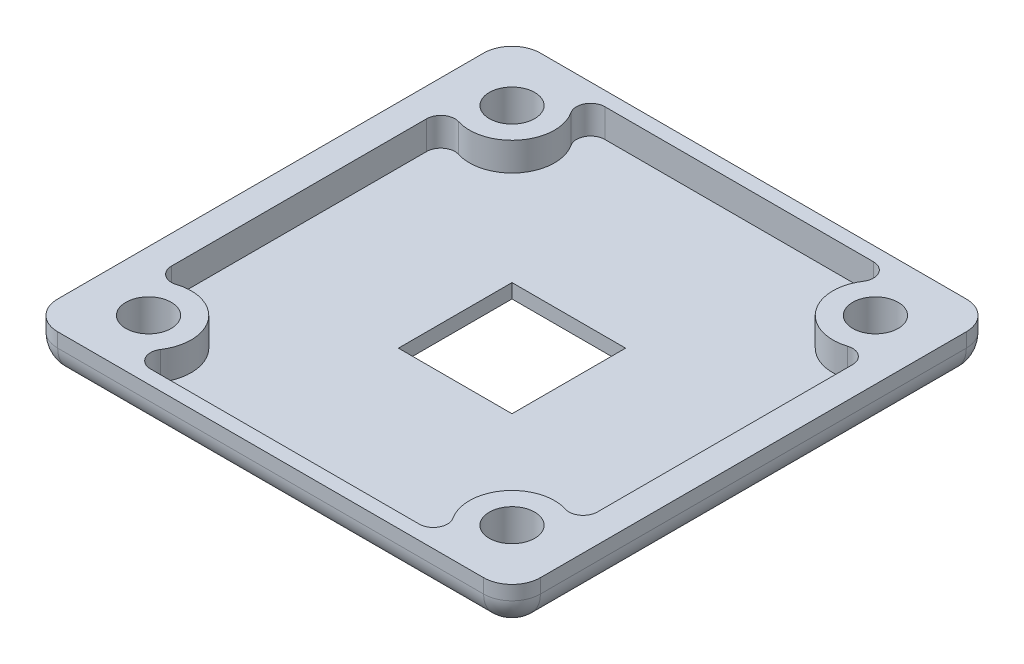
from build123d import *

# Parameters (mm, degrees)
SKETCH1_W           = 26.9875
SKETCH1_H           = 26.9875
BOSS_EXTRUDE1_DEPTH = 2.38125
SKETCH2_W           = 6.35
SKETCH2_H           = 6.35
CUT_EXTRUDE1_DEPTH  = 20.231040785
SKETCH3_R           = 1.27
CUT_EXTRUDE2_DEPTH  = 20.231040785
CUT_EXTRUDE3_DEPTH  = 1.5875
FILLET1_R           = 1.5875
FILLET2_R           = 1.5875


with BuildPart() as part:
    # Sketch1 → Boss-Extrude1 (new body)
    with BuildSketch(Plane(origin=(0, 0, 0), x_dir=(1, 0, 0), z_dir=(0, 1, 0))):
        Rectangle(SKETCH1_W, SKETCH1_H)
    extrude(amount=BOSS_EXTRUDE1_DEPTH)

    # Sketch2 → Cut-Extrude1 (cut, through all)
    with BuildSketch(Plane(origin=(0, 2.38125, 0), x_dir=(1, 0, 0), z_dir=(0, 1, 0))):
        Rectangle(SKETCH2_W, SKETCH2_H)
    extrude(amount=-CUT_EXTRUDE1_DEPTH, mode=Mode.SUBTRACT)

    # Sketch3 → Cut-Extrude2 (cut, through all)
    with BuildSketch(Plane(origin=(0, 2.38125, 0), x_dir=(1, 0, 0), z_dir=(0, 1, 0))):
        with Locations(Location((-10.16, 10.16, 0), (0, 0, 270))):
            Circle(SKETCH3_R)
        with Locations(Location((10.16, 10.16, 0), (0, 0, 270))):
            Circle(SKETCH3_R)
        with Locations(Location((10.16, -10.16, 0), (0, 0, 270))):
            Circle(SKETCH3_R)
        with Locations(Location((-10.16, -10.16, 0), (0, 0, 270))):
            Circle(SKETCH3_R)
    extrude(amount=-CUT_EXTRUDE2_DEPTH, mode=Mode.SUBTRACT)

    # Sketch4 → Cut-Extrude3 (cut)
    with BuildSketch(Plane(origin=(0, 2.38125, 0), x_dir=(1, 0, 0), z_dir=(0, 1, 0))):
        with BuildLine():
            Line((-11.90625, -7.131243036), (-11.90625, 7.131243036))
            ThreePointArc((-11.90625, 7.131243036), (-11.582088833, 7.771184744), (-10.874375, 7.888432277))
            ThreePointArc((-10.874375, 7.888432277), (-8.259382698, 8.725424998), (-8.171264167, 11.4696875))
            ThreePointArc((-8.171264167, 11.4696875), (-8.207122766, 12.282758684), (-7.508352222, 12.7))
            Line((-7.508352222, 12.7), (7.508352222, 12.7))
            ThreePointArc((7.508352222, 12.7), (8.207122766, 12.282758684), (8.171264167, 11.4696875))
            ThreePointArc((8.171264167, 11.4696875), (8.259382698, 8.725424998), (10.874375, 7.888432277))
            ThreePointArc((10.874375, 7.888432277), (11.582088833, 7.771184744), (11.90625, 7.131243036))
            Line((11.90625, 7.131243036), (11.90625, -7.131243036))
            ThreePointArc((11.90625, -7.131243036), (11.582088833, -7.771184744), (10.874375, -7.888432277))
            ThreePointArc((10.874375, -7.888432277), (8.259382698, -8.725424998), (8.171264167, -11.4696875))
            ThreePointArc((8.171264167, -11.4696875), (8.207122766, -12.282758684), (7.508352222, -12.7))
            Line((7.508352222, -12.7), (-7.508352222, -12.7))
            ThreePointArc((-7.508352222, -12.7), (-8.207122766, -12.282758684), (-8.171264167, -11.4696875))
            ThreePointArc((-8.171264167, -11.4696875), (-8.259382698, -8.725424998), (-10.874375, -7.888432277))
            ThreePointArc((-10.874375, -7.888432277), (-11.582088833, -7.771184744), (-11.90625, -7.131243036))
        make_face()
    extrude(amount=-CUT_EXTRUDE3_DEPTH, mode=Mode.SUBTRACT)

    # Fillet1
    fillet1_edges = [part.edges().sort_by_distance(p)[0] for p in [
        (13.49375, 1.190625, 13.49375),
        (-13.49375, 1.190625, 13.49375),
        (-13.49375, 1.190625, -13.49375),
        (13.49375, 1.190625, -13.49375),
    ]]
    fillet(fillet1_edges, radius=FILLET1_R)

    # Fillet2
    fillet2_edges = [part.edges().sort_by_distance(p)[0] for p in [
        (13.49375, 0, 0),
        (0, 0, 13.49375),
        (-13.49375, 0, 0),
        (0, 0, -13.49375),
        (-13.028782015, 0, 13.028782015),
        (-13.028782015, 0, -13.028782015),
        (13.028782015, 0, -13.028782015),
        (13.028782015, 0, 13.028782015),
    ]]
    fillet(fillet2_edges, radius=FILLET2_R)


solid = part.part
